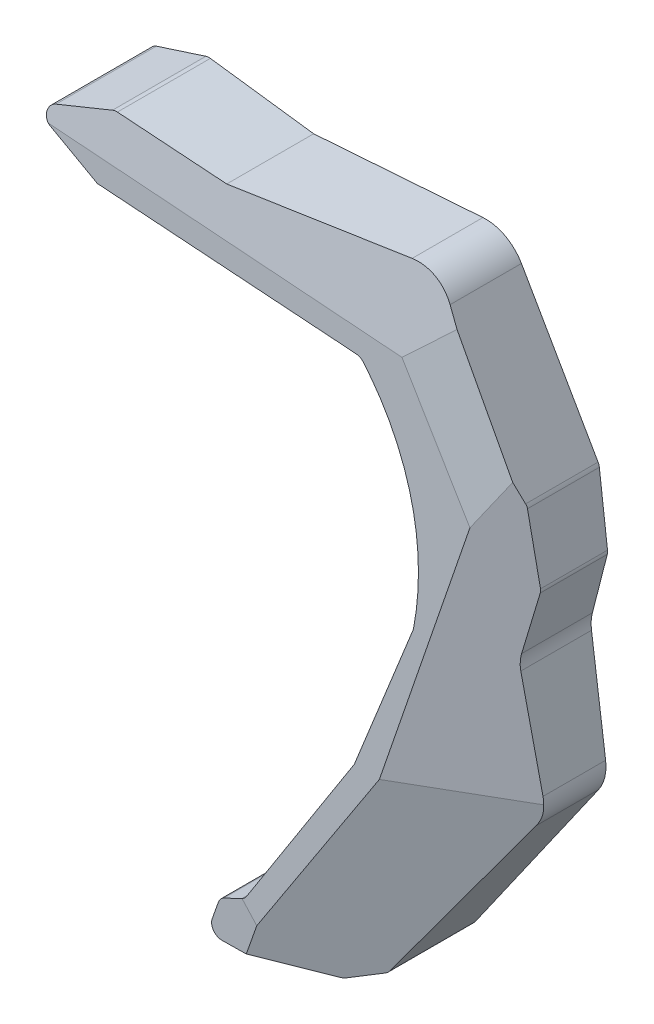
from build123d import *

# Parameters (mm, degrees)
BOSS_EXTRUDE1_DEPTH      = 19.05
BOSS_EXTRUDE1_DEPTH_BACK = 19.05
SKETCH4_W                = 186.379734437
SKETCH4_H                = 233.28599277
CUT_EXTRUDE1_DEPTH       = 950.835438404
SKETCH7_W                = 231.95079804
SKETCH7_H                = 221.677656062
CUT_EXTRUDE2_DEPTH       = 946.905059587
SKETCH11_W               = 173.814101514
SKETCH11_H               = 248.849814079
CUT_EXTRUDE4_DEPTH       = 941.51899366
SKETCH14_W               = 196.129851378
SKETCH14_H               = 225.619542635
CUT_EXTRUDE5_DEPTH       = 907.478686006
SKETCH17_W               = 176.819121146
SKETCH17_H               = 184.843776095
CUT_EXTRUDE6_DEPTH       = 913.1190158


with BuildPart() as part:
    # Sketch1 → Boss-Extrude1 (new, two sides: drawn at the far end of the back side and taken through both)
    with BuildSketch(Plane.XY.offset(-BOSS_EXTRUDE1_DEPTH_BACK)):
        with BuildLine():
            Line((832.012207401, 74.98328443), (830.051592511, 69.443138151))
            ThreePointArc((830.051592511, 69.443138151), (830.464037195, 66.534350889), (833.086070249, 65.20917293))
            Line((833.086070249, 65.20917293), (861.746459213, 65.582718771))
            ThreePointArc((861.746459213, 65.582718771), (862.436541417, 65.667855132), (863.091543165, 65.90116685))
            Line((863.091543165, 65.90116685), (872.196833975, 70.320946588))
            ThreePointArc((872.196833975, 70.320946588), (872.869650438, 70.760620145), (873.410502549, 71.355156792))
            Line((873.410502549, 71.355156792), (911.54502985, 125.773830324))
            ThreePointArc((911.54502985, 125.773830324), (913.483046359, 130.053718288), (913.732471748, 134.745320994))
            Line((913.732471748, 134.745320994), (909.364571394, 167.411013692))
            ThreePointArc((909.364571394, 167.411013692), (909.274481854, 169.840517815), (909.648990135, 172.242673089))
            Line((909.648990135, 172.242673089), (914.241820235, 190.190541175))
            ThreePointArc((914.241820235, 190.190541175), (914.334181602, 190.770696206), (914.318077922, 191.357936492))
            Line((914.318077922, 191.357936492), (911.790756949, 212.30686176))
            ThreePointArc((911.790756949, 212.30686176), (911.6522039, 212.92602807), (911.39330486, 213.505282035))
            Line((911.39330486, 213.505282035), (887.679344514, 254.884009975))
            ThreePointArc((887.679344514, 254.884009975), (882.632176652, 259.777683565), (875.755211166, 261.236892374))
            Line((875.755211166, 261.236892374), (823.370254465, 257.492913183))
            Line((823.370254465, 257.492913183), (791.391520556, 261.712016844))
            ThreePointArc((791.391520556, 261.712016844), (790.689315821, 261.726304443), (790.001151085, 261.585859009))
            Line((790.001151085, 261.585859009), (774.713390941, 256.652413374))
            ThreePointArc((774.713390941, 256.652413374), (772.534709623, 253.997511187), (774.046182712, 250.913583981))
            Line((774.046182712, 250.913583981), (788.122630404, 242.405939005))
            Line((788.122630404, 242.405939005), (863.909526126, 232.407020034))
            ThreePointArc((863.909526126, 232.407020034), (865.004538197, 232.052074317), (865.901029602, 231.330034804))
            ThreePointArc((865.901029602, 231.330034804), (881.520213, 202.699806258), (884.038410967, 170.183540241))
            ThreePointArc((884.038410967, 170.183540241), (883.978058807, 169.861693272), (883.884877802, 169.547774246))
            Line((883.884877802, 169.547774246), (869.294437604, 128.319293639))
            ThreePointArc((869.294437604, 128.319293639), (869.171364398, 128.020746389), (869.018602643, 127.736244508))
            Line((869.018602643, 127.736244508), (840.618152355, 80.745866559))
            ThreePointArc((840.618152355, 80.745866559), (840.040651792, 80.042509109), (839.287349373, 79.531868269))
            Line((839.287349373, 79.531868269), (833.618845344, 76.780331852))
            ThreePointArc((833.618845344, 76.780331852), (832.638350308, 76.040211187), (832.012207401, 74.98328443))
        make_face()
    extrude(amount=BOSS_EXTRUDE1_DEPTH + BOSS_EXTRUDE1_DEPTH_BACK)

    # Sketch4 → Cut-Extrude1 (cut, through all)
    with BuildSketch(Plane(origin=(5.154747967, 4.689434257, 78.383097783), x_dir=(0.9978522316377796, -0.003911988654162224, -0.06538822646526604), z_dir=(0.06550514342785009, 0.05959206261409093, 0.9960712134470584))):
        with Locations((842.981546385, 161.984148681)):
            Rectangle(SKETCH4_W, SKETCH4_H)
    extrude(amount=CUT_EXTRUDE1_DEPTH, mode=Mode.SUBTRACT)

    # Sketch7 → Cut-Extrude2 (cut, through all)
    with BuildSketch(Plane(origin=(9.762038751, 21.716896374, 118.29137191), x_dir=(0.9953503159229875, -0.06617162100827076, -0.06999332228967761), z_dir=(0.08090274831952654, 0.17997844984324457, 0.9803379534152342))):
        with Locations((824.773818159, 194.950225871)):
            Rectangle(SKETCH7_W, SKETCH7_H)
    extrude(amount=CUT_EXTRUDE2_DEPTH, mode=Mode.SUBTRACT)

    # Sketch11 → Cut-Extrude4 (cut, through all)
    with BuildSketch(Plane(origin=(23.549231024, 17.716627358, 158.48607319), x_dir=(0.988547763362636, -0.054240482201212636, -0.14082361180324135), z_dir=(0.14608467838170588, 0.1099028586949763, 0.983148324716462))):
        with Locations((809.66383823, 157.140332284)):
            Rectangle(SKETCH11_W, SKETCH11_H)
    extrude(amount=CUT_EXTRUDE4_DEPTH, mode=Mode.SUBTRACT)

    # Sketch14 → Cut-Extrude5 (cut, through all)
    with BuildSketch(Plane(origin=(106.606514907, -8.105609994, 291.517937711), x_dir=(0.9391673216400718, 0.019492950361294347, -0.3429063528860705), z_dir=(0.3433326783617723, -0.026104603375052715, 0.9388510114238378))):
        with Locations((805.668145938, 138.128050957)):
            Rectangle(SKETCH14_W, SKETCH14_H)
    extrude(amount=CUT_EXTRUDE5_DEPTH, mode=Mode.SUBTRACT)

    # Sketch17 → Cut-Extrude6 (cut, through all)
    with BuildSketch(Plane(origin=(107.883108977, -38.087973047, 283.754367701), x_dir=(0.9357682343427207, 0.04691042077342712, -0.34948136433573534), z_dir=(0.3526156712273392, -0.12449044441681217, 0.9274504394595959))):
        with Locations((808.154549648, 102.775727883)):
            Rectangle(SKETCH17_W, SKETCH17_H)
    extrude(amount=CUT_EXTRUDE6_DEPTH, mode=Mode.SUBTRACT)


solid = part.part
